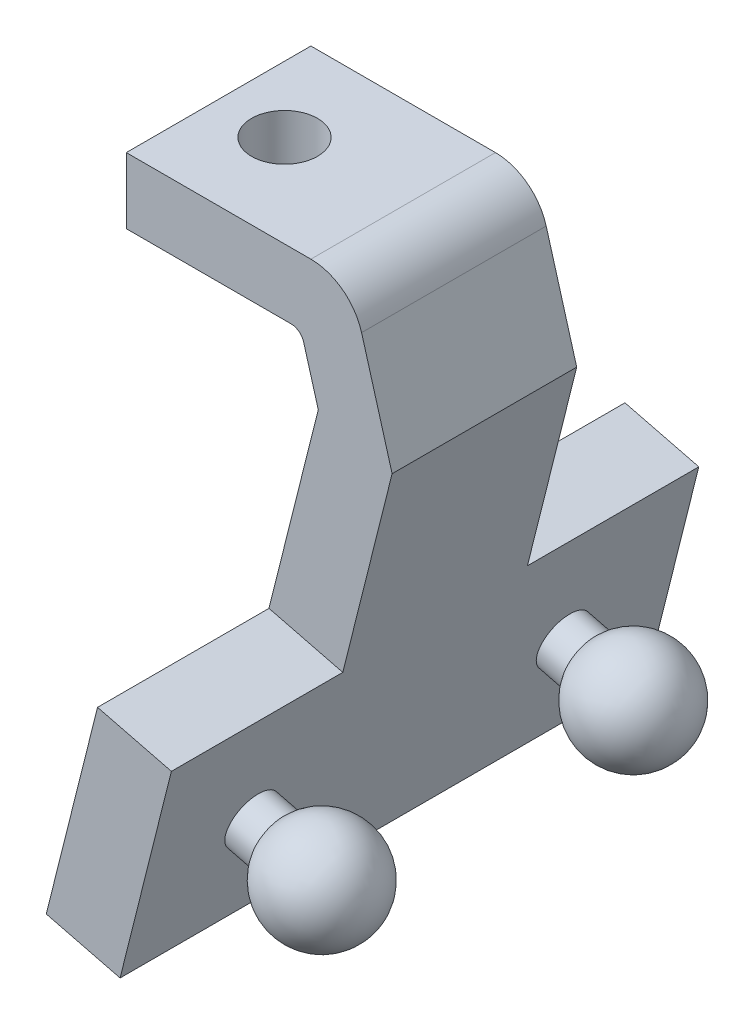
from build123d import *
from build123d.topology import SkipClean

# Parameters (mm, degrees)
EXTRUDE_1_DEPTH     = 3.5
SKETCH_2_R          = 1.25
CUT_EXTRUDE_3_DEPTH = 5.5
SKETCH_3_W          = 20
SKETCH_3_H          = 8
EXTRUDE_2_DEPTH     = 2.886751
SKETCH_4_R          = 1
EXTRUDE_3_DEPTH     = 1


with BuildPart() as part:
    # 草图1 → 凸台-拉伸1 (new, symmetric)
    with BuildSketch(Plane.XY):
        with BuildLine():
            Line((0, 0), (6.245432753, 0))
            ThreePointArc((6.245432753, 0), (6.54659813, -0.100876691), (6.72624124, -0.362802336))
            Line((6.72624124, -0.362802336), (7.280170813, -2.304045596))
            Line((7.280170813, -2.304045596), (3.464823209, -17.52278731))
            Line((3.464823209, -17.52278731), (6.264921184, -18.224773538))
            Line((6.264921184, -18.224773538), (10.080268787, -3.006031824))
            Line((10.080268787, -3.006031824), (8.923233948, 1.048790655))
            ThreePointArc((8.923233948, 1.048790655), (8.204661507, 2.096493237), (7, 2.5))
            Line((7, 2.5), (0, 2.5))
            Line((0, 2.5), (0, 0))
        make_face()
    extrude(amount=EXTRUDE_1_DEPTH, both=True)

    # 草图2 → 切除-拉伸3 (cut)
    with BuildSketch(Plane.XZ):
        with Locations((2.5, 0)):
            Circle(SKETCH_2_R)
    extrude(amount=-CUT_EXTRUDE_3_DEPTH, mode=Mode.SUBTRACT)

    # 草图3 → 凸台-拉伸2 (add)
    with SkipClean():  # the faces are left unmerged after this step: merging them gives an invalid solid
        with BuildSketch(Plane(origin=(10.193230201, -2.555448877, 0), x_dir=(0, 0, -1), z_dir=(0.969982391695105, -0.24317516279719864, 0))):
            with Locations((0, -12.154236196)):
                Rectangle(SKETCH_3_W, SKETCH_3_H)
        extrude(amount=-EXTRUDE_2_DEPTH)

    # 草图4 → 凸台-拉伸3 (add)
    with SkipClean():  # the faces are left unmerged after this step: merging them gives an invalid solid
        with BuildSketch(Plane(origin=(10.193230201, -2.555448877, 0), x_dir=(0, 0, -1), z_dir=(0.969982391695105, -0.24317516279719864, 0))):
            with Locations(Location((-5.905792995, -12.438753462, 0), (0, 0, 270))):
                Circle(SKETCH_4_R)
        extrude_3 = extrude(amount=EXTRUDE_3_DEPTH)

    # 草图5 → 旋转1 (revolve)
    with SkipClean():  # the faces are left unmerged after this step: merging them gives an invalid solid
        with BuildSketch(Plane(origin=(-3.024795898, -12.065371833, 0), x_dir=(-0.969982391695105, 0.24317516279719864, 0), z_dir=(0.24317516279719864, 0.969982391695105, 0))):
            with BuildLine():
                Line((-11.508675506, 5.905792995), (-15.240726313, 5.905792995))
                ThreePointArc((-15.240726313, 5.905792995), (-13.758364403, 7.837644647), (-11.508675506, 6.905792995))
                Line((-11.508675506, 6.905792995), (-11.508675506, 5.905792995))
            make_face()
        revolve_1 = revolve(axis=Axis((8.138416694, -14.863995872, 5.905792995), (0.969982391695105, -0.24317516279719817, 0)))

    # 镜向1: 凸台-拉伸3, 旋转1 across plane
    with SkipClean():  # the faces are left unmerged after this step: merging them gives an invalid solid
        add(extrude_3.mirror(Plane.XY))
        add(revolve_1.mirror(Plane.XY))


solid = part.part
